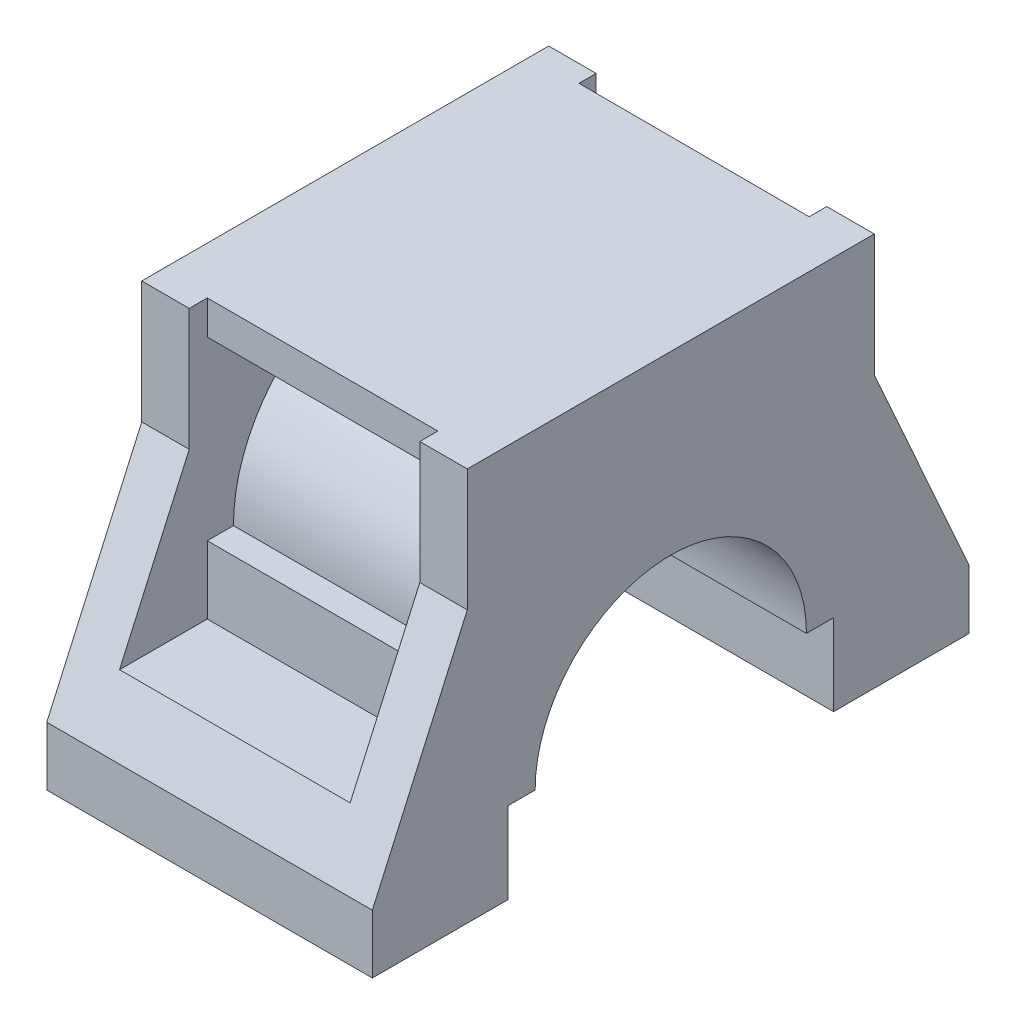
from build123d import *

# Parameters (mm, degrees)
BOSS_EXTRUDE1_DEPTH = 48
CUT_EXTRUDE1_DEPTH  = 34
SKETCH4_W           = 34
SKETCH4_H           = 5.062205584
BOSS_EXTRUDE2_DEPTH = 10
SKETCH6_W           = 34
SKETCH6_H           = 31
CUT_EXTRUDE3_DEPTH  = 101.30083919
BOSS_EXTRUDE3_DEPTH = 34
SKETCH9_W           = 34
SKETCH9_H           = 5.06
BOSS_EXTRUDE4_DEPTH = 10
BOSS_EXTRUDE5_DEPTH = 5


with BuildPart() as part:
    # Sketch1 → Boss-Extrude1 (new body)
    with BuildSketch(Plane(origin=(0, 0, 0), x_dir=(0, 0, -1), z_dir=(1, 0, 0))):
        with BuildLine():
            Line((-22.763988027, 0), (-22.763988027, 8.659101585))
            Line((-22.763988027, 8.659101585), (-8.763988027, 40))
            Line((-8.763988027, 40), (-8.763988027, 58))
            Line((-8.763988027, 58), (51.236011973, 58))
            Line((51.236011973, 58), (51.236011973, 40))
            Line((51.236011973, 40), (65.236011973, 8.659101585))
            Line((65.236011973, 8.659101585), (65.236011973, 0))
            Line((65.236011973, 0), (45.236011973, 0))
            Line((45.236011973, 0), (45.236011973, 12))
            Line((45.236011973, 12), (41.236011973, 12))
            ThreePointArc((41.236011973, 12), (21.236011973, 32), (1.236011973, 12))
            Line((1.236011973, 12), (-2.763988027, 12))
            Line((-2.763988027, 12), (-2.763988027, 0))
            Line((-2.763988027, 0), (-22.763988027, 0))
        make_face()
    extrude(amount=-BOSS_EXTRUDE1_DEPTH)

    # Sketch3 → Cut-Extrude1 (cut)
    with BuildSketch(Plane(origin=(-7, 0, 0), x_dir=(0, 0, -1), z_dir=(1, 0, 0))):
        Polygon((-19.038103202, 17), (-1.038103202, 17), (-1.038103202, 58), (-8.763988027, 58), (-8.763988027, 40), align=None)
    extrude(amount=-CUT_EXTRUDE1_DEPTH, mode=Mode.SUBTRACT)

    # Sketch4 → Boss-Extrude2 (add)
    with BuildSketch(Plane(origin=(0, 17, 0), x_dir=(1, 0, 0), z_dir=(0, 1, 0))):
        with Locations((-24, -3.569205994)):
            Rectangle(SKETCH4_W, SKETCH4_H)
    extrude(amount=BOSS_EXTRUDE2_DEPTH)

    # Sketch6 → Cut-Extrude3 (cut, through all)
    with BuildSketch(Plane.XY.offset(1.038103202)):
        with Locations((-24, 42.5)):
            Rectangle(SKETCH6_W, SKETCH6_H)
    extrude(amount=-CUT_EXTRUDE3_DEPTH, mode=Mode.SUBTRACT)

    # Sketch8 → Boss-Extrude3 (add)
    with BuildSketch(Plane(origin=(-41, 0, 0), x_dir=(0, 0, -1), z_dir=(1, 0, 0))):
        with BuildLine():
            Line((-2.24605546, 27), (45.75394454, 27))
            ThreePointArc((45.75394454, 27), (21.75394454, 51), (-2.24605546, 27))
        make_face()
    extrude(amount=BOSS_EXTRUDE3_DEPTH)

    # Sketch9 → Boss-Extrude4 (add)
    with BuildSketch(Plane(origin=(0, 27, 0), x_dir=(1, 0, 0), z_dir=(0, 1, 0))):
        with Locations((-24, 46.107548199)):
            Rectangle(SKETCH9_W, SKETCH9_H)
    extrude(amount=BOSS_EXTRUDE4_DEPTH)

    # Sketch10 → Boss-Extrude5 (add)
    with BuildSketch(Plane(origin=(0, 58, 0), x_dir=(1, 0, 0), z_dir=(0, 1, 0))):
        Polygon((-41, 48.707326909), (-7, 48.637548199), (-7, -6.100308786), (-41, -6.100308786), align=None)
    extrude(amount=-BOSS_EXTRUDE5_DEPTH)


solid = part.part
